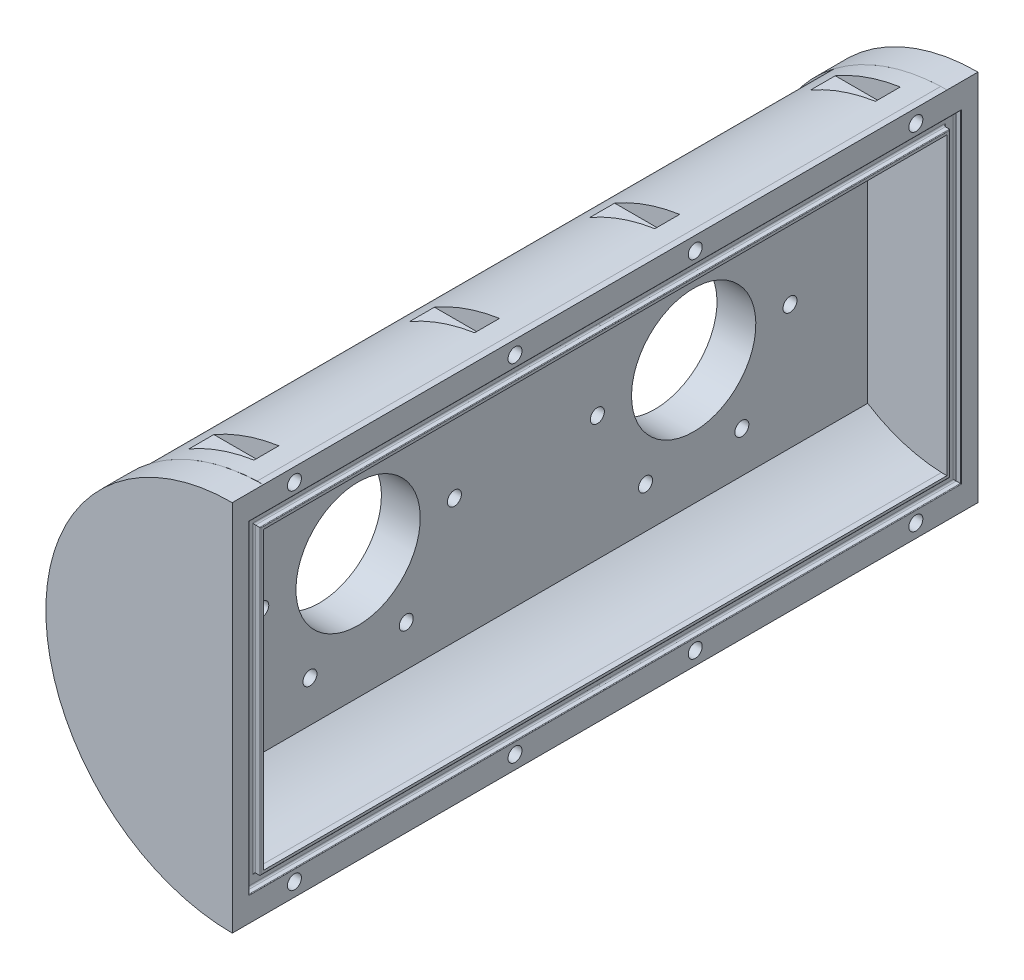
from build123d import *

# Parameters (mm, degrees)
BOSS_EXTRUDE1_DEPTH            = 110
BOSS_EXTRUDE3_START            = -120
BOSS_EXTRUDE3_DEPTH            = 10
CUT_EXTRUDE1_START             = 60
SKETCH11_W                     = 8
SKETCH11_H                     = 8
CUT_EXTRUDE1_DEPTH             = 51
M4_CLEARANCE_HOLE5_D           = 4.5
M4_CLEARANCE_HOLE5_CSINK_D     = 4.55
M4_CLEARANCE_HOLE5_CSINK_ANGLE = 90
CUT_EXTRUDE2_START             = -20
SKETCH14_R                     = 20
CUT_EXTRUDE2_DEPTH             = 48
CUT_EXTRUDE4_START             = -2
CUT_EXTRUDE4_DEPTH             = 149.969384567
SKETCH33_W                     = 5
SKETCH33_H                     = 6
M4_CLEARANCE_HOLE3_D           = 4.5
M4_CLEARANCE_HOLE3_CSINK_D     = 4.55
M4_CLEARANCE_HOLE3_CSINK_ANGLE = 90
CIRPATTERN7_COUNT              = 6
FILLET1_R                      = 0.5
FILLET2_R                      = 0.2
MIRROR_MID_COPY_1_D            = 4.5
MIRROR_MID_COPY_1_CSINK_D      = 4.55
MIRROR_MID_COPY_1_CSINK_ANGLE  = 90
MIRROR_MID_COPY_2_D            = 4.5
MIRROR_MID_COPY_2_CSINK_D      = 4.55
MIRROR_MID_COPY_2_CSINK_ANGLE  = 90
MIRROR_MID_COPY_3_D            = 4.5
MIRROR_MID_COPY_3_CSINK_D      = 4.55
MIRROR_MID_COPY_3_CSINK_ANGLE  = 90
MIRROR_MID_COPY_4_D            = 4.5
MIRROR_MID_COPY_4_CSINK_D      = 4.55
MIRROR_MID_COPY_4_CSINK_ANGLE  = 90
MIRROR_MID_COPY_5_D            = 4.5
MIRROR_MID_COPY_5_CSINK_D      = 4.55
MIRROR_MID_COPY_5_CSINK_ANGLE  = 90
FILLET1_OF_MIRROR_MID_R        = 0.5
FILLET2_OF_MIRROR_MID_R        = 0.2


with BuildPart() as part:
    # Sketch1 → Boss-Extrude1 (new body)
    with BuildSketch(Plane.XY):
        with BuildLine():
            Line((0, 60), (-2, 60))
            ThreePointArc((-2, 60), (-19.920365303, 56.606909458), (-36.000491256, 47.999813239))
            ThreePointArc((-36.000491256, 47.999813239), (-37.472273263, 46.235975068), (-38, 44.000181729))
            Line((-38, 44.000181729), (-38, -44.000181729))
            ThreePointArc((-38, -44.000181729), (-37.472273263, -46.235975068), (-36.000491256, -47.999813239))
            ThreePointArc((-36.000491256, -47.999813239), (-19.920365303, -56.606909458), (-2, -60))
            Line((-2, -60), (0, -60))
            Line((0, -60), (0, -47.5))
            Line((0, -47.5), (-1.768750835, -47.5))
            ThreePointArc((-1.768750835, -47.5), (-14.127016384, -45.362963672), (-25.5, -40.076292196))
            Line((-25.5, -40.076292196), (-25.5, 40.076292196))
            ThreePointArc((-25.5, 40.076292196), (-14.127016384, 45.362963672), (-1.768750835, 47.5))
            Line((-1.768750835, 47.5), (0, 47.5))
            Line((0, 47.5), (0, 60))
        make_face()
    boss_extrude1 = extrude(amount=-BOSS_EXTRUDE1_DEPTH)

    # Sketch7 → Boss-Extrude3 (add)
    with BuildSketch(Plane.XY.offset(BOSS_EXTRUDE3_START)):
        with BuildLine():
            Line((0, 60), (0, -60))
            ThreePointArc((0, -60), (-60, 0), (0, 60))
        make_face()
    boss_extrude3 = extrude(amount=BOSS_EXTRUDE3_DEPTH)

    # Sketch11 → Cut-Extrude1 (cut)
    with BuildSketch(Plane(origin=(0, 0, 0), x_dir=(0, 0, -1), z_dir=(-1, 0, 0)).offset(CUT_EXTRUDE1_START)):
        with Locations((29, 56)):
            Rectangle(SKETCH11_W, SKETCH11_H)
        with Locations((100, -56)):
            Rectangle(SKETCH11_W, SKETCH11_H)
        with Locations((29, -56)):
            Rectangle(SKETCH11_W, SKETCH11_H)
        with Locations((100, 56)):
            Rectangle(SKETCH11_W, SKETCH11_H)
    cut_extrude1 = extrude(amount=-CUT_EXTRUDE1_DEPTH, mode=Mode.SUBTRACT)

    # M4 Clearance Hole5 (through all)
    with Locations(Plane.ZY.offset(9)):
        with Locations((-100, 55.672055005), (-29, 55.672055005), (-100, -55.672055005), (-29, -55.672055005)):
            m4_clearance_hole5 = CounterSinkHole(M4_CLEARANCE_HOLE5_D / 2, M4_CLEARANCE_HOLE5_CSINK_D / 2, counter_sink_angle=M4_CLEARANCE_HOLE5_CSINK_ANGLE)

    # Sketch14 → Cut-Extrude2 (cut)
    with BuildSketch(Plane(origin=(0, 0, 0), x_dir=(0, 0, -1), z_dir=(1, 0, 0)).offset(CUT_EXTRUDE2_START)):
        with Locations(Location((54, 0, 0), (0, 0, 270))):
            Circle(SKETCH14_R)
    cut_extrude2 = extrude(amount=-CUT_EXTRUDE2_DEPTH, mode=Mode.SUBTRACT)

    # Sketch32 → Cut-Extrude4 (cut)
    with BuildSketch(Plane(origin=(0, 0, 0), x_dir=(0, 0, -1), z_dir=(1, 0, 0)).offset(CUT_EXTRUDE4_START)):
        Polygon((110, 48.5), (0, 48.5), (0, 52), (110, 52), (114.5, 52), (114.5, -52), (0, -52), (0, -48.5), (111, -48.5), (111, 48.5), align=None)
    cut_extrude4 = extrude(amount=CUT_EXTRUDE4_DEPTH, mode=Mode.SUBTRACT)

    # Sketch33 → Cut-Revolve1 (revolve, cut)
    with BuildSketch(Plane.XY.offset(-54), mode=Mode.PRIVATE) as cut_revolve1_sk:
        with Locations((-35.5, -24)):
            Rectangle(SKETCH33_W, SKETCH33_H)
    cut_revolve1 = revolve(cut_revolve1_sk.sketch.rotate(Axis((11.844603506, 0, -54), (-1, 0, 0)), 180), axis=Axis((11.844603506, 0, -54), (-1, 0, 0)), mode=Mode.SUBTRACT)

    # M4 Clearance Hole3 (through all)
    with Locations(Plane.ZY.offset(38)):
        with Locations((-85, 0)):
            m4_clearance_hole3 = CounterSinkHole(M4_CLEARANCE_HOLE3_D / 2, M4_CLEARANCE_HOLE3_CSINK_D / 2, counter_sink_angle=M4_CLEARANCE_HOLE3_CSINK_ANGLE)

    # CirPattern7: M4 Clearance Hole3 ×6 about axis
    cirpattern7_axis = Axis((0, 0, -54), (1, 0, 0))
    for i in range(1, CIRPATTERN7_COUNT):
        add(m4_clearance_hole3.rotate(cirpattern7_axis, i * 360 / CIRPATTERN7_COUNT), mode=Mode.SUBTRACT)

    # Fillet1
    fillet1_edges = [part.edges().sort_by_distance(p)[0] for p in [
        (-2, 0, -111),
        (-2, 48.5, -55.5),
        (-2, -48.5, -55.5),
        (-2, 52, -57.25),
        (-2, 0, -114.5),
        (-2, -52, -57.25),
    ]]
    fillet(fillet1_edges, radius=FILLET1_R)

    # Fillet2
    fillet2_edges = [part.edges().sort_by_distance(p)[0] for p in [
        (0, 0, -114.5),
        (0, 0, -111),
        (0, 48.5, -55.5),
        (0, -52, -57.25),
        (0, 52, -57.25),
        (0, -48.5, -55.5),
        (-33, -27, -54),
        (-33, -21, -54),
    ]]
    fillet(fillet2_edges, radius=FILLET2_R)

    # Mirror_mid: Boss-Extrude1, Boss-Extrude3, Cut-Extrude1, M4 Clearance Hole5, Cut-Extrude2, Cut-Extrude4, Cut-Revolve1, M4 Clearance Hole3 across plane
    add(boss_extrude1.mirror(Plane.XY))
    add(boss_extrude3.mirror(Plane.XY))
    add(cut_extrude1.mirror(Plane.XY), mode=Mode.SUBTRACT)
    add(m4_clearance_hole5.mirror(Plane.XY), mode=Mode.SUBTRACT)
    add(cut_extrude2.mirror(Plane.XY), mode=Mode.SUBTRACT)
    add(cut_extrude4.mirror(Plane.XY), mode=Mode.SUBTRACT)
    add(cut_revolve1.mirror(Plane.XY), mode=Mode.SUBTRACT)
    add(m4_clearance_hole3.mirror(Plane.XY), mode=Mode.SUBTRACT)

    # Mirror_mid copy 1 (through all)
    with Locations(Plane(origin=(-38, -46.765371804, 27), x_dir=(0, -0.8660254037844386, -0.5000000000000001), z_dir=(-1, 0, 0))):
        with Locations((-85, 0)):
            CounterSinkHole(MIRROR_MID_COPY_1_D / 2, MIRROR_MID_COPY_1_CSINK_D / 2, counter_sink_angle=MIRROR_MID_COPY_1_CSINK_ANGLE)

    # Mirror_mid copy 2 (through all)
    with Locations(Plane(origin=(-38, -46.765371804, 81), x_dir=(0, -0.8660254037844387, 0.4999999999999998), z_dir=(-1, 0, 0))):
        with Locations((-85, 0)):
            CounterSinkHole(MIRROR_MID_COPY_2_D / 2, MIRROR_MID_COPY_2_CSINK_D / 2, counter_sink_angle=MIRROR_MID_COPY_2_CSINK_ANGLE)

    # Mirror_mid copy 3 (through all)
    with Locations(Plane(origin=(-38, 0, 108), x_dir=(0, 0, 1), z_dir=(-1, 0, 0))):
        with Locations((-85, 0)):
            CounterSinkHole(MIRROR_MID_COPY_3_D / 2, MIRROR_MID_COPY_3_CSINK_D / 2, counter_sink_angle=MIRROR_MID_COPY_3_CSINK_ANGLE)

    # Mirror_mid copy 4 (through all)
    with Locations(Plane(origin=(-38, 46.765371804, 81), x_dir=(0, 0.8660254037844384, 0.5000000000000004), z_dir=(-1, 0, 0))):
        with Locations((-85, 0)):
            CounterSinkHole(MIRROR_MID_COPY_4_D / 2, MIRROR_MID_COPY_4_CSINK_D / 2, counter_sink_angle=MIRROR_MID_COPY_4_CSINK_ANGLE)

    # Mirror_mid copy 5 (through all)
    with Locations(Plane(origin=(-38, 46.765371804, 27), x_dir=(0, 0.8660254037844386, -0.5000000000000001), z_dir=(-1, 0, 0))):
        with Locations((-85, 0)):
            CounterSinkHole(MIRROR_MID_COPY_5_D / 2, MIRROR_MID_COPY_5_CSINK_D / 2, counter_sink_angle=MIRROR_MID_COPY_5_CSINK_ANGLE)

    # Fillet1 of Mirror_mid
    fillet1_of_mirror_mid_edges = [part.edges().sort_by_distance(p)[0] for p in [
        (-2, 0, 111),
        (-2, 48.5, 55.5),
        (-2, -48.5, 55.5),
        (-2, 52, 57.25),
        (-2, 0, 114.5),
        (-2, -52, 57.25),
    ]]
    fillet(fillet1_of_mirror_mid_edges, radius=FILLET1_OF_MIRROR_MID_R)

    # Fillet2 of Mirror_mid
    fillet2_of_mirror_mid_edges = [part.edges().sort_by_distance(p)[0] for p in [
        (0, 0, 114.5),
        (0, 0, 111),
        (0, 48.5, 55.5),
        (0, -52, 57.25),
        (0, 52, 57.25),
        (0, -48.5, 55.5),
        (-33, -27, 54),
        (-33, -21, 54),
    ]]
    fillet(fillet2_of_mirror_mid_edges, radius=FILLET2_OF_MIRROR_MID_R)


solid = part.part
